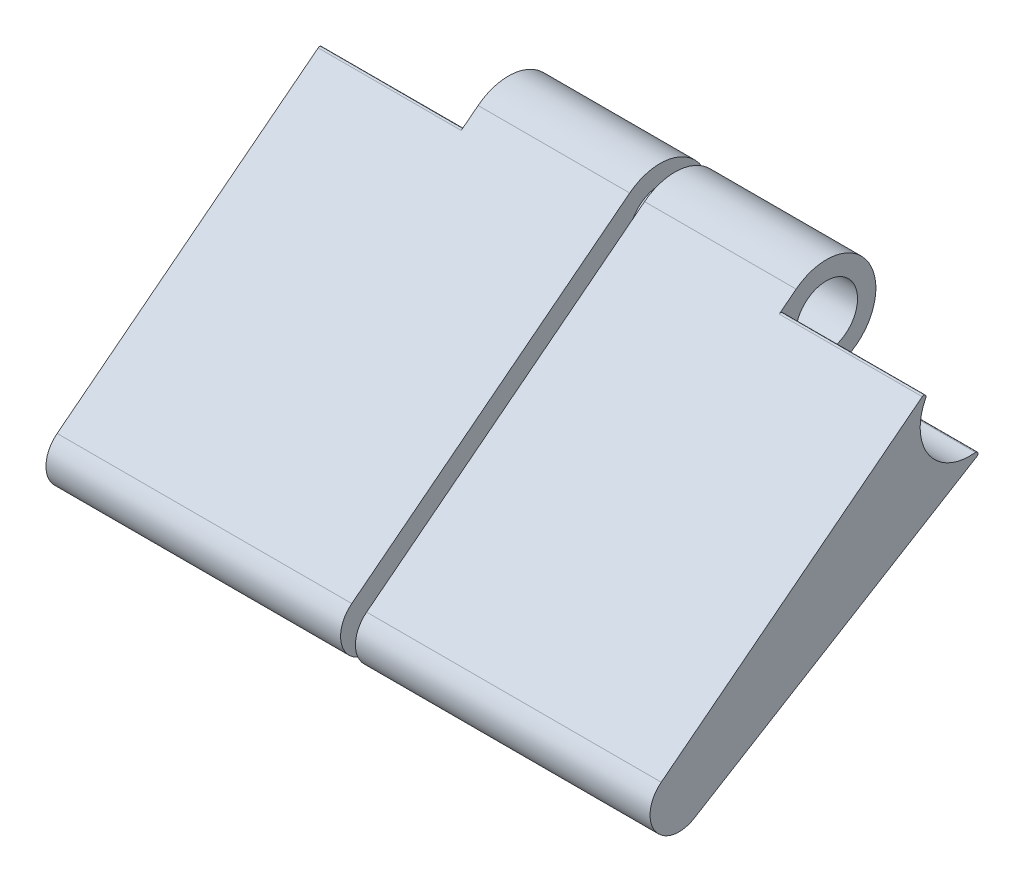
from build123d import *

# Parameters (mm, degrees)
SKETCH_1_R               = 1.335133797
SKETCH_1_R_2             = 1.25
EXTRUDE_1_DEPTH          = 12.680489019
SKETCH_2_R               = 2.125
SKETCH_2_R_2             = 1.335133797
CUT_EXTRUDE_1_DEPTH      = 6.156235
CUT_EXTRUDE_5_DEPTH      = 110.304219163
CUT_EXTRUDE_5_DEPTH_BACK = 6.156235


with BuildPart() as part:
    # 草图1 → 凸台-拉伸1 (new body)
    # profile 1 of 4: a face of its own
    with BuildSketch(Plane(origin=(70.25, 0, 0), x_dir=(0, 0, -1), z_dir=(1, 0, 0))):
        with BuildLine():
            ThreePointArc((-83.320828703, -41.475641317), (-82.582973687, -41.458678011), (-81.895424365, -41.19036158))
            ThreePointArc((-81.895424365, -41.19036158), (-81.147589648, -40.416249676), (-80.875, -39.375))
            ThreePointArc((-80.875, -39.375), (-81.49739809, -37.87239809), (-83, -37.25))
            ThreePointArc((-83, -37.25), (-83.690491555, -37.365311862), (-84.306044883, -37.698732789))
            ThreePointArc((-84.306044883, -37.698732789), (-85.056195254, -39.911363753), (-83.320828703, -41.475641317))
        make_face()
        with Locations((-83, -39.375)):
            Circle(SKETCH_1_R, mode=Mode.SUBTRACT)
    # profile 2 of 4: a face of its own
    with BuildSketch(Plane(origin=(70.25, 0, 0), x_dir=(0, 0, -1), z_dir=(1, 0, 0))):
        with BuildLine():
            ThreePointArc((-94.25, -48.005), (-94.410346852, -48.617499809), (-94.850249627, -49.072859753))
            Line((-94.850249627, -49.072859753), (-82.556206377, -41.592421268))
            Line((-82.556206377, -41.592421268), (-83.320828703, -41.475641317))
            ThreePointArc((-83.320828703, -41.475641317), (-85.056195254, -39.911363753), (-84.306044883, -37.698732789))
            Line((-84.306044883, -37.698732789), (-96.268261696, -47.018960464))
            ThreePointArc((-96.268261696, -47.018960464), (-94.951286559, -46.881873311), (-94.25, -48.005))
        make_face()
    # profile 3 of 4: a face of its own
    with BuildSketch(Plane(origin=(70.25, 0, 0), x_dir=(0, 0, -1), z_dir=(1, 0, 0))):
        with Locations((-95.5, -48.005)):
            Circle(SKETCH_1_R_2)
    # profile 4 of 4: a face of its own
    with BuildSketch(Plane(origin=(70.25, 0, 0), x_dir=(0, 0, -1), z_dir=(1, 0, 0))):
        with BuildLine():
            Line((-83.320828703, -41.475641317), (-82.556206377, -41.592421268))
            Line((-82.556206377, -41.592421268), (-81.895424365, -41.19036158))
            ThreePointArc((-81.895424365, -41.19036158), (-82.582973687, -41.458678011), (-83.320828703, -41.475641317))
        make_face()
    extrude(amount=-EXTRUDE_1_DEPTH)

    # 草图2 → 切除-拉伸1 (cut)
    with BuildSketch(Plane(origin=(70.25, 0, 0), x_dir=(0, 0, -1), z_dir=(1, 0, 0))):
        with Locations((-83, -39.375)):
            Circle(SKETCH_2_R)
        with Locations((-83, -39.375)):
            Circle(SKETCH_2_R_2, mode=Mode.SUBTRACT)
    extrude(amount=-CUT_EXTRUDE_1_DEPTH, mode=Mode.SUBTRACT)

    # 草图3 → 切除-拉伸5 (cut, two sides: drawn at the far end of the back side and taken through both)
    with BuildSketch(Plane(origin=(70.25, 0, 0), x_dir=(0, 0, -1), z_dir=(1, 0, 0)).offset(-CUT_EXTRUDE_5_DEPTH_BACK)):
        with BuildLine():
            Line((-84.067543243, -37.446744777), (-85.737782144, -37.446744777))
            Line((-85.737782144, -37.446744777), (-85.737782144, -38.573168545))
            Line((-85.737782144, -38.573168545), (-85.428355461, -38.573168545))
            Line((-85.428355461, -38.573168545), (-85.03331171, -38.265374617))
            Line((-85.03331171, -38.265374617), (-84.306044883, -37.698732789))
            ThreePointArc((-84.306044883, -37.698732789), (-84.631726105, -38.013715709), (-84.883228268, -38.390583273))
            ThreePointArc((-84.883228268, -38.390583273), (-84.927734779, -38.480872703), (-84.967915475, -38.573168545))
            Line((-84.967915475, -38.573168545), (-84.067543243, -38.573168545))
            Line((-84.067543243, -38.573168545), (-84.067543243, -37.446744777))
        make_face()
        with BuildLine():
            Line((-84.306044883, -37.698732789), (-85.03331171, -38.265374617))
            ThreePointArc((-85.03331171, -38.265374617), (-84.907790337, -38.267470669), (-84.883228268, -38.390583273))
            ThreePointArc((-84.883228268, -38.390583273), (-84.631726105, -38.013715709), (-84.306044883, -37.698732789))
        make_face()
        with BuildLine():
            Line((-83.072778558, -40.826749326), (-83.072778558, -41.498753348))
            ThreePointArc((-83.072778558, -41.498753348), (-82.909586711, -41.498075702), (-82.746928098, -41.484876682))
            ThreePointArc((-82.746928098, -41.484876682), (-82.305387522, -41.383267538), (-81.895424365, -41.19036158))
            Line((-81.895424365, -41.19036158), (-82.683038802, -41.669593777))
            Line((-82.683038802, -41.669593777), (-83.072778558, -41.906734984))
            Line((-83.072778558, -41.906734984), (-83.072778558, -42.126751075))
            Line((-83.072778558, -42.126751075), (-81.512776459, -42.126751075))
            Line((-81.512776459, -42.126751075), (-81.512776459, -40.826749326))
            Line((-81.512776459, -40.826749326), (-83.072778558, -40.826749326))
        make_face()
        with BuildLine():
            ThreePointArc((-81.895424365, -41.19036158), (-82.305387522, -41.383267538), (-82.746928098, -41.484876682))
            ThreePointArc((-82.746928098, -41.484876682), (-82.640512125, -41.55147735), (-82.683038802, -41.669593777))
            Line((-82.683038802, -41.669593777), (-81.895424365, -41.19036158))
        make_face()
    extrude(amount=CUT_EXTRUDE_5_DEPTH + CUT_EXTRUDE_5_DEPTH_BACK, mode=Mode.SUBTRACT)


with BuildPart() as body_2:
    # 镜向3: mirrored copy
    add(part.part.mirror(Plane(origin=(57.25, 0, 0), x_dir=(0, 0, 1), z_dir=(1, 0, 0))))


solid = Compound([part.part, body_2.part])
